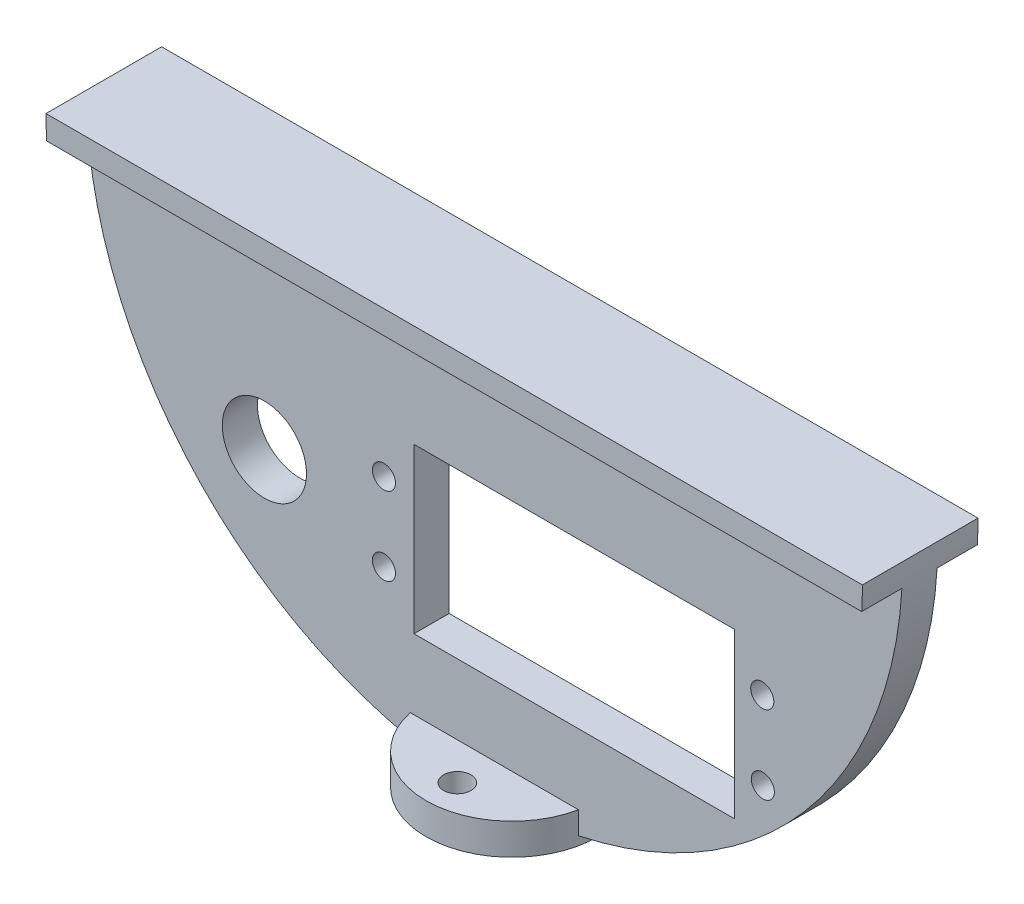
from build123d import *

# Parameters (mm, degrees)
EXTRUDE_1_DEPTH     = 4.5
EXTRUDE_2_DEPTH     = 7.4
SKETCH_3_R          = 11
EXTRUDE_3_DEPTH     = 4
CUT_EXTRUDE_2_REACH = 77.071
SKETCH_7_R          = 1.75
SKETCH_10_R         = 1.478021834
SKETCH_10_W         = 41
SKETCH_10_H         = 21
CUT_EXTRUDE_3_DEPTH = 14
SKETCH_12_R         = 5.390059672
CUT_EXTRUDE_4_DEPTH = 15


with BuildPart() as part:
    # 草图1 → 凸台-拉伸1 (new body)
    with BuildSketch(Plane.XY):
        with BuildLine():
            Line((-52.25, 0), (52.25, 0))
            ThreePointArc((52.25, 0), (0, -52.25), (-52.25, 0))
        make_face()
    extrude(amount=EXTRUDE_1_DEPTH)

    # 草图2 → 凸台-拉伸2 (add, symmetric)
    with BuildSketch(Plane.XY.offset(2.25)):
        with BuildLine():
            Line((-52.25, 0), (52.25, 0))
            ThreePointArc((52.25, 0), (52.22844668, -1.500619011), (52.163804501, -3))
            Line((52.163804501, -3), (-52.163804501, -3))
            ThreePointArc((-52.163804501, -3), (-52.22844668, -1.500619011), (-52.25, 0))
        make_face()
    extrude(amount=EXTRUDE_2_DEPTH, both=True)

    # 草图3 → 凸台-拉伸3 (add)
    with BuildSketch(Plane(origin=(0, -52.25, 0), x_dir=(1, 0, 0), z_dir=(0, 1, 0))):
        with Locations(Location((0, -2.25, 0), (0, 0, 168.19710831))):
            Circle(SKETCH_3_R)
    extrude(amount=EXTRUDE_3_DEPTH)

    # 草图7 → 切除-拉伸2 (cut, up to next)
    with BuildSketch(Plane.XZ.offset(52.25), mode=Mode.PRIVATE) as cut_extrude_2_sk1:
        with Locations(Location((0, 9.25, 0), (0, 0, 270))):
            Circle(SKETCH_7_R)
    cut_extrude_2_tool1 = extrude(cut_extrude_2_sk1.sketch, amount=-CUT_EXTRUDE_2_REACH, mode=Mode.PRIVATE) & part.part
    # 草图7 → 切除-拉伸2 (cut, up to next)
    with BuildSketch(Plane.XZ.offset(52.25), mode=Mode.PRIVATE) as cut_extrude_2_sk2:
        with Locations(Location((0, -4.75, 0), (0, 0, 270))):
            Circle(SKETCH_7_R)
    cut_extrude_2_tool2 = extrude(cut_extrude_2_sk2.sketch, amount=-CUT_EXTRUDE_2_REACH, mode=Mode.PRIVATE) & part.part
    add(cut_extrude_2_tool1.solids().sort_by_distance((0, -52.25, 9.25))[0], mode=Mode.SUBTRACT)
    add(cut_extrude_2_tool2.solids().sort_by_distance((0, -52.25, -4.75))[0], mode=Mode.SUBTRACT)

    # 草图10 → 切除-拉伸3 (cut)
    with BuildSketch(Plane.XY.offset(4.5)):
        with Locations((-14.143943937, -23.76680221)):
            Circle(SKETCH_10_R)
        with Locations((34.286056063, -23.76680221)):
            Circle(SKETCH_10_R)
        with Locations((-14.143943937, -33.76680221)):
            Circle(SKETCH_10_R)
        with Locations((34.356056063, -33.76680221)):
            Circle(SKETCH_10_R)
        with Locations((10.206056063, -28.76680221)):
            Rectangle(SKETCH_10_W, SKETCH_10_H)
    extrude(amount=-CUT_EXTRUDE_3_DEPTH, mode=Mode.SUBTRACT)

    # 草图12 → 切除-拉伸4 (cut)
    with BuildSketch(Plane.XY.offset(4.5)):
        with Locations((-29.445394051, -28.42542141)):
            Circle(SKETCH_12_R)
    extrude(amount=-CUT_EXTRUDE_4_DEPTH, mode=Mode.SUBTRACT)


solid = part.part
